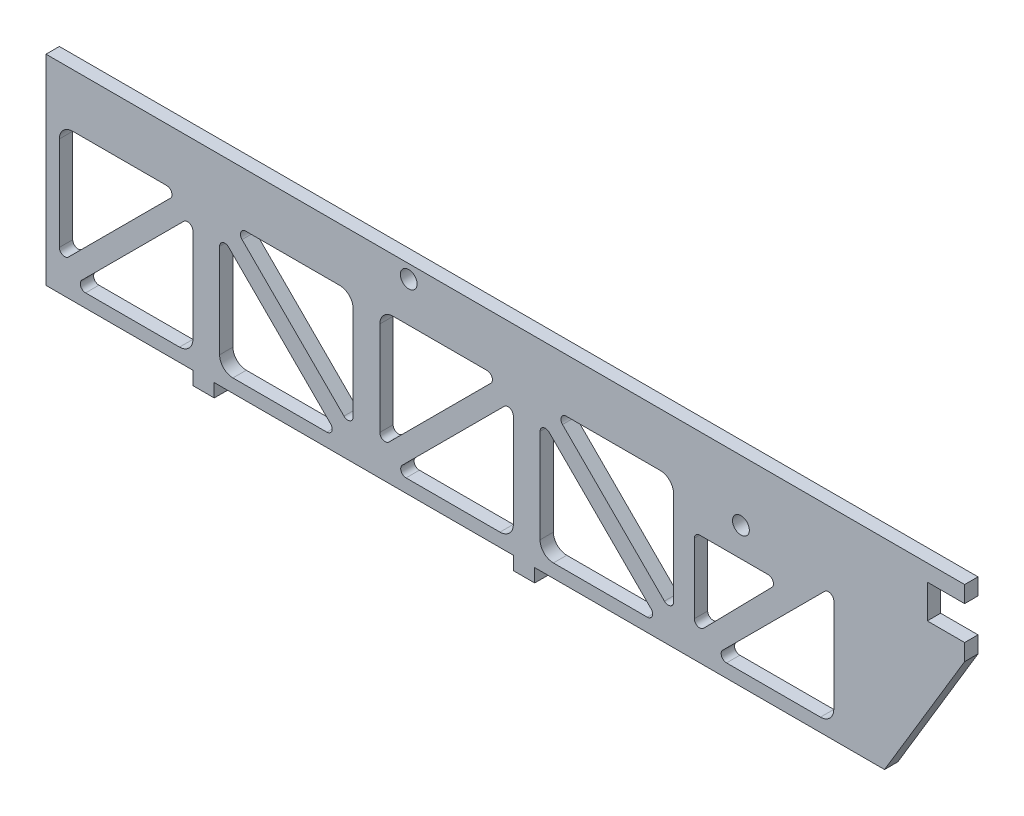
from build123d import *

# Parameters (mm, degrees)
MODEL_R             = 4
BOSS_EXTRUDE2_DEPTH = 6.35
SKETCH1_W           = 10.16
SKETCH1_H           = 6.35
BOSS_EXTRUDE3_DEPTH = 6.35


with BuildPart() as part:
    # Model → Boss-Extrude2 (new body)
    with BuildSketch(Plane.XY):
        Polygon((419.1, 87.376), (419.1, 71.374), (436.88, 71.374), (436.88, 63.5), (398.78, 0), (0, 0), (0, 95.25), (436.88, 95.25), (436.88, 87.376), align=None)
        with Locations((172.491700482, 88.801347744)):
            Circle(MODEL_R, mode=Mode.SUBTRACT)
        with Locations((330.479700482, 66.449347744)):
            Circle(MODEL_R, mode=Mode.SUBTRACT)
        with BuildLine():
            Line((312.685453403, 15.123873353), (345.228141797, 48.298807013))
            ThreePointArc((345.228141797, 48.298807013), (345.756846653, 51.060789203), (343.414895332, 52.617496771))
            Line((343.414895332, 52.617496771), (310.872206937, 52.617496771))
            ThreePointArc((310.872206937, 52.617496771), (309.076155713, 51.873547995), (308.332206937, 50.077496771))
            Line((308.332206937, 50.077496771), (308.332206937, 16.902563111))
            ThreePointArc((308.332206937, 16.902563111), (309.911490023, 14.551260704), (312.685453403, 15.123873353))
        make_face(mode=Mode.SUBTRACT)
        with BuildLine():
            Line((171.232102448, 6.35), (215.9, 6.35))
            ThreePointArc((215.9, 6.35), (220.390128061, 8.209871939), (222.25, 12.7))
            Line((222.25, 12.7), (222.25, 57.367897552))
            ThreePointArc((222.25, 57.367897552), (220.682015918, 59.714551565), (217.913948776, 59.163948776))
            Line((217.913948776, 59.163948776), (169.436051224, 10.686051224))
            ThreePointArc((169.436051224, 10.686051224), (168.885448435, 7.917984082), (171.232102448, 6.35))
        make_face(mode=Mode.SUBTRACT)
        with BuildLine():
            Line((234.95, 57.367897552), (234.95, 12.7))
            ThreePointArc((234.95, 12.7), (236.809871939, 8.209871939), (241.3, 6.35))
            Line((241.3, 6.35), (285.967897552, 6.35))
            ThreePointArc((285.967897552, 6.35), (288.314551565, 7.917984082), (287.763948776, 10.686051224))
            Line((287.763948776, 10.686051224), (239.286051224, 59.163948776))
            ThreePointArc((239.286051224, 59.163948776), (236.517984082, 59.714551565), (234.95, 57.367897552))
        make_face(mode=Mode.SUBTRACT)
        with BuildLine():
            Line((294.113948776, 17.036051224), (245.636051224, 65.513948776))
            ThreePointArc((245.636051224, 65.513948776), (245.085448435, 68.282015918), (247.432102448, 69.85))
            Line((247.432102448, 69.85), (292.1, 69.85))
            ThreePointArc((292.1, 69.85), (296.590128061, 67.990128061), (298.45, 63.5))
            Line((298.45, 63.5), (298.45, 18.832102448))
            ThreePointArc((298.45, 18.832102448), (296.882015918, 16.485448435), (294.113948776, 17.036051224))
        make_face(mode=Mode.SUBTRACT)
        with BuildLine():
            Line((323.632102448, 6.35), (368.3, 6.35))
            ThreePointArc((368.3, 6.35), (372.790128061, 8.209871939), (374.65, 12.7))
            Line((374.65, 12.7), (374.65, 57.367897552))
            ThreePointArc((374.65, 57.367897552), (373.082015918, 59.714551565), (370.313948776, 59.163948776))
            Line((370.313948776, 59.163948776), (321.836051224, 10.686051224))
            ThreePointArc((321.836051224, 10.686051224), (321.285448435, 7.917984082), (323.632102448, 6.35))
        make_face(mode=Mode.SUBTRACT)
        with BuildLine():
            Line((18.832102448, 6.35), (63.5, 6.35))
            ThreePointArc((63.5, 6.35), (67.990128061, 8.209871939), (69.85, 12.7))
            Line((69.85, 12.7), (69.85, 57.367897552))
            ThreePointArc((69.85, 57.367897552), (68.282015918, 59.714551565), (65.513948776, 59.163948776))
            Line((65.513948776, 59.163948776), (17.036051224, 10.686051224))
            ThreePointArc((17.036051224, 10.686051224), (16.485448435, 7.917984082), (18.832102448, 6.35))
        make_face(mode=Mode.SUBTRACT)
        with BuildLine():
            Line((82.55, 57.367897552), (82.55, 12.7))
            ThreePointArc((82.55, 12.7), (84.409871939, 8.209871939), (88.9, 6.35))
            Line((88.9, 6.35), (133.567897552, 6.35))
            ThreePointArc((133.567897552, 6.35), (135.914551565, 7.917984082), (135.363948776, 10.686051224))
            Line((135.363948776, 10.686051224), (86.886051224, 59.163948776))
            ThreePointArc((86.886051224, 59.163948776), (84.117984082, 59.714551565), (82.55, 57.367897552))
        make_face(mode=Mode.SUBTRACT)
        with BuildLine():
            Line((93.236051224, 65.513948776), (141.713948776, 17.036051224))
            ThreePointArc((141.713948776, 17.036051224), (144.482015918, 16.485448435), (146.05, 18.832102448))
            Line((146.05, 18.832102448), (146.05, 63.5))
            ThreePointArc((146.05, 63.5), (144.190128061, 67.990128061), (139.7, 69.85))
            Line((139.7, 69.85), (95.032102448, 69.85))
            ThreePointArc((95.032102448, 69.85), (92.685448435, 68.282015918), (93.236051224, 65.513948776))
        make_face(mode=Mode.SUBTRACT)
        with BuildLine():
            Line((163.086051224, 17.036051224), (211.563948776, 65.513948776))
            ThreePointArc((211.563948776, 65.513948776), (212.114551565, 68.282015918), (209.767897552, 69.85))
            Line((209.767897552, 69.85), (165.1, 69.85))
            ThreePointArc((165.1, 69.85), (160.609871939, 67.990128061), (158.75, 63.5))
            Line((158.75, 63.5), (158.75, 18.832102448))
            ThreePointArc((158.75, 18.832102448), (160.317984082, 16.485448435), (163.086051224, 17.036051224))
        make_face(mode=Mode.SUBTRACT)
        with BuildLine():
            Line((6.35, 63.5), (6.35, 18.832102448))
            ThreePointArc((6.35, 18.832102448), (7.917984082, 16.485448435), (10.686051224, 17.036051224))
            Line((10.686051224, 17.036051224), (59.163948776, 65.513948776))
            ThreePointArc((59.163948776, 65.513948776), (59.714551565, 68.282015918), (57.367897552, 69.85))
            Line((57.367897552, 69.85), (12.7, 69.85))
            ThreePointArc((12.7, 69.85), (8.209871939, 67.990128061), (6.35, 63.5))
        make_face(mode=Mode.SUBTRACT)
    extrude(amount=BOSS_EXTRUDE2_DEPTH)

    # Sketch1 → Boss-Extrude3 (add)
    with BuildSketch(Plane.XY.offset(6.35)):
        with Locations((74.93, -3.175)):
            Rectangle(SKETCH1_W, SKETCH1_H)
        with Locations((227.33, -3.175)):
            Rectangle(SKETCH1_W, SKETCH1_H)
    extrude(amount=-BOSS_EXTRUDE3_DEPTH)


solid = part.part
